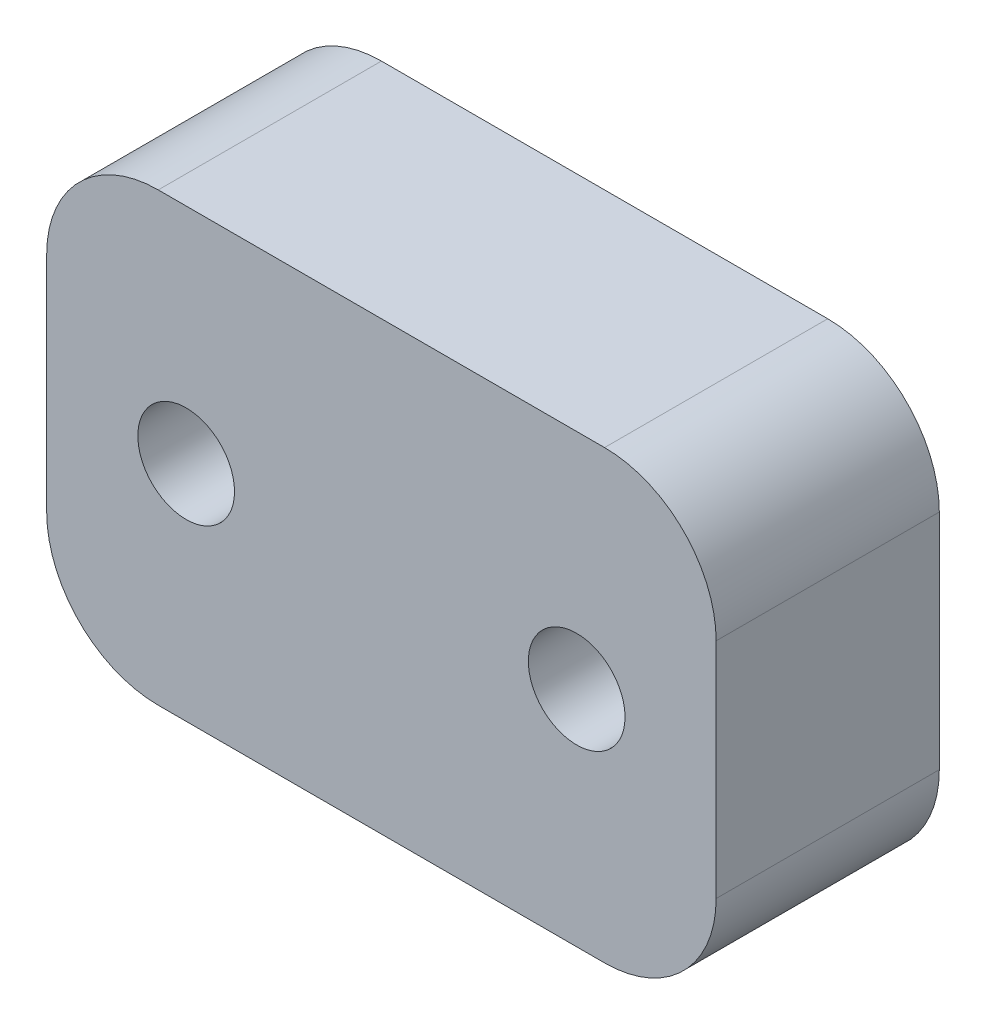
from build123d import *

# Parameters (mm, degrees)
CROQUIS2_W              = 18
CROQUIS2_H              = 12
CROQUIS2_R              = 1.3
SALIENTE_EXTRUIR1_DEPTH = 6
REDONDEO1_R             = 3


with BuildPart() as part:
    # Croquis2 → Saliente-Extruir1 (new body)
    with BuildSketch(Plane.XY):
        Rectangle(CROQUIS2_W, CROQUIS2_H)
        with Locations((-5.25, 0)):
            Circle(CROQUIS2_R, mode=Mode.SUBTRACT)
        with Locations((5.25, 0)):
            Circle(CROQUIS2_R, mode=Mode.SUBTRACT)
    extrude(amount=SALIENTE_EXTRUIR1_DEPTH)

    # Redondeo1
    redondeo1_edges = [part.edges().sort_by_distance(p)[0] for p in [
        (-9, 6, 3),
        (9, 6, 3),
        (9, -6, 3),
        (-9, -6, 3),
    ]]
    fillet(redondeo1_edges, radius=REDONDEO1_R)


solid = part.part
